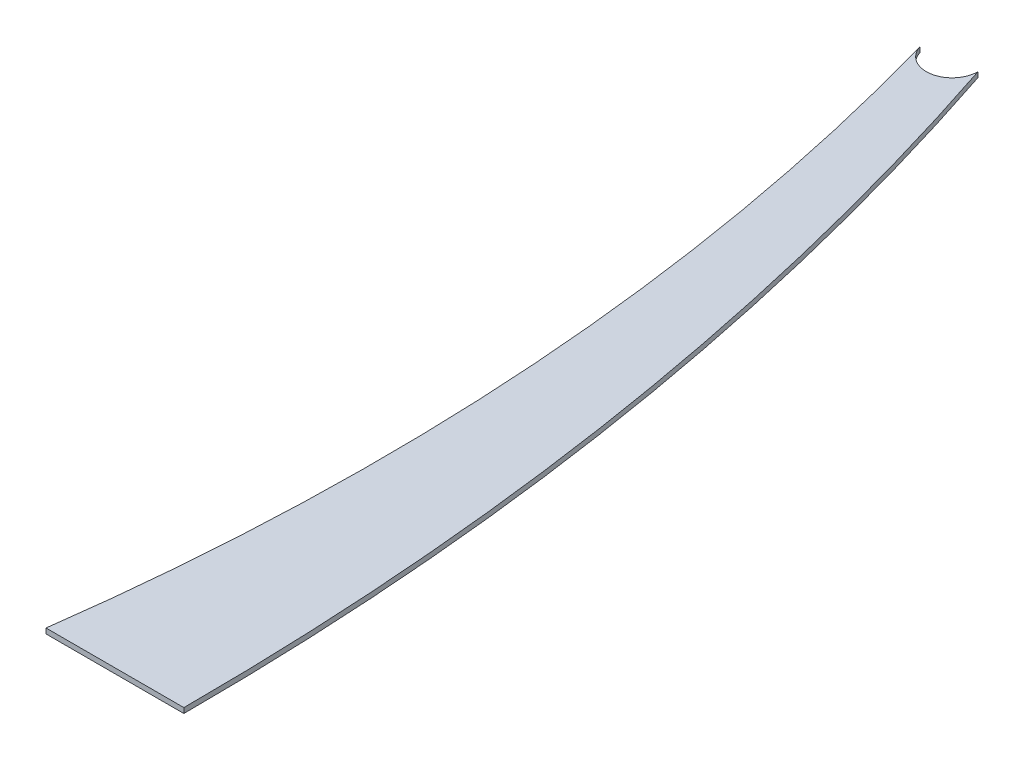
from build123d import *

# Parameters (mm, degrees)
EXTRUDE_1_DEPTH = 3


with BuildPart() as part:
    # Эскиз1 → Бобышка-Вытянуть1 (new, symmetric)
    with BuildSketch(Plane(origin=(0, 0, 0), x_dir=(1, 0, 0), z_dir=(0, 1, 0))):
        with BuildLine():
            Line((0, 0), (160, 0))
            ThreePointArc((160, 0), (115.131768996, 557.179686061), (-18.316601125, 1100))
            ThreePointArc((-18.316601125, 1100), (-44.186405055, 1070.28566877), (-77.179366487, 1091.818265728))
            ThreePointArc((-77.179366487, 1091.818265728), (17.74272232, 549.891205257), (0, 0))
        make_face()
    extrude(amount=EXTRUDE_1_DEPTH, both=True)


solid = part.part
